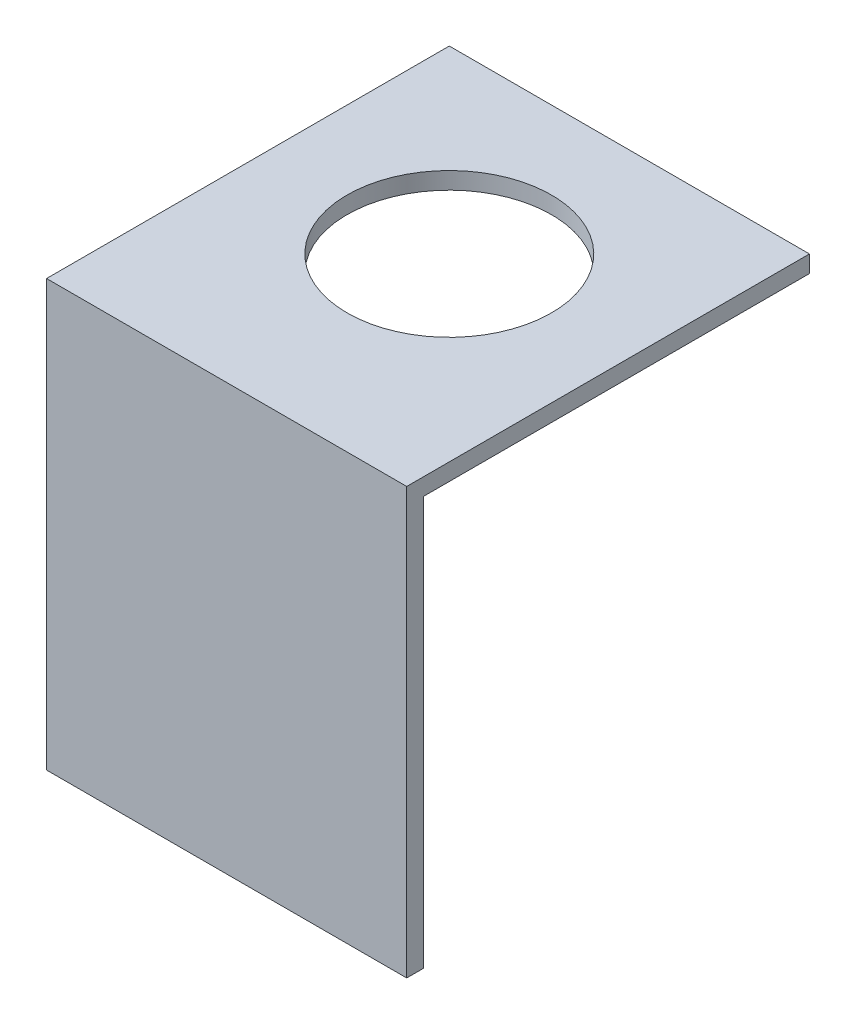
from build123d import *

# Parameters (mm, degrees)
SKIZZE1_W                       = 42.3
SKIZZE1_H                       = 47.3
SKIZZE1_R                       = 12
AUFSATZ_LINEAR_AUSTRAGEN1_DEPTH = 2
SKIZZE2_W                       = 42.3
SKIZZE2_H                       = 2
AUFSATZ_LINEAR_AUSTRAGEN2_DEPTH = 48


with BuildPart() as part:
    # Skizze1 → Aufsatz-Linear austragen1 (new body)
    with BuildSketch(Plane(origin=(0, 12.133771831, 0), x_dir=(1, 0, 0), z_dir=(0, 1, 0))):
        with Locations((-2.775765494, -2.5)):
            Rectangle(SKIZZE1_W, SKIZZE1_H)
        with Locations(Location((-2.775765494, 0, 0), (0, 0, 270))):
            Circle(SKIZZE1_R, mode=Mode.SUBTRACT)
    extrude(amount=AUFSATZ_LINEAR_AUSTRAGEN1_DEPTH)

    # Skizze2 → Aufsatz-Linear austragen2 (add)
    with BuildSketch(Plane.XZ.offset(-12.133771831)):
        with Locations((-2.775765494, 25.15)):
            Rectangle(SKIZZE2_W, SKIZZE2_H)
    extrude(amount=AUFSATZ_LINEAR_AUSTRAGEN2_DEPTH)


solid = part.part
